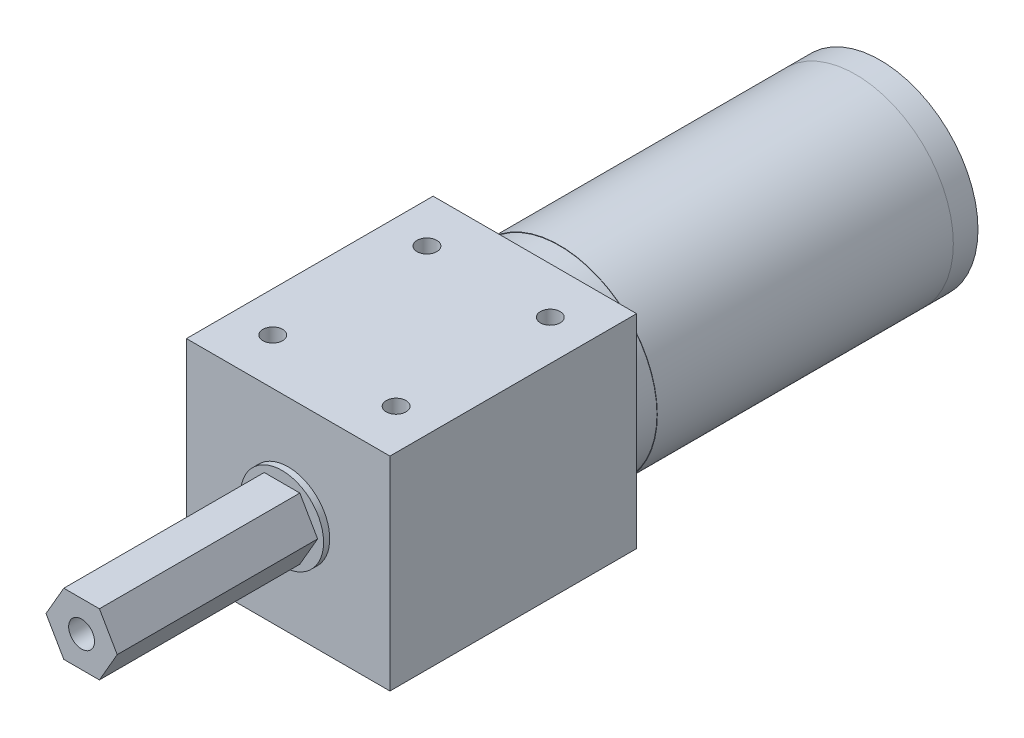
from build123d import *

# Parameters (mm, degrees)
SKETCH1_W           = 41.91
SKETCH1_H           = 41.91
BOSS_EXTRUDE1_DEPTH = 50.8
BOSS_EXTRUDE2_DEPTH = 42.545
SKETCH3_R           = 20.066
BOSS_EXTRUDE3_DEPTH = 5.08
SKETCH4_R           = 20.141371121
BOSS_EXTRUDE4_DEPTH = 60.96
SKETCH5_R           = 20.141371121
BOSS_EXTRUDE5_DEPTH = 5.08
SKETCH6_R           = 8.554692431
BOSS_EXTRUDE6_DEPTH = 1.27
SKETCH7_R           = 2.667
CUT_EXTRUDE1_DEPTH  = 19.05
SKETCH8_R           = 2.032
CUT_EXTRUDE2_DEPTH  = 8.89


with BuildPart() as part:
    # Sketch1 → Boss-Extrude1 (new body)
    with BuildSketch(Plane.XY):
        with Locations((20.955, 20.955)):
            Rectangle(SKETCH1_W, SKETCH1_H)
    extrude(amount=BOSS_EXTRUDE1_DEPTH)

    # Sketch2 → Boss-Extrude2 (add)
    with BuildSketch(Plane.XY.offset(50.8)):
        Polygon((28.287348419, 20.955), (24.621174209, 27.305), (17.288825791, 27.305), (13.622651581, 20.955), (17.288825791, 14.605), (24.621174209, 14.605), align=None)
    extrude(amount=BOSS_EXTRUDE2_DEPTH)

    # Sketch3 → Boss-Extrude3 (add)
    with BuildSketch(Plane(origin=(0, 0, 0), x_dir=(-1, 0, 0), z_dir=(0, 0, -1))):
        with Locations((-20.955, 20.955)):
            Circle(SKETCH3_R)
    extrude(amount=BOSS_EXTRUDE3_DEPTH)

    # Sketch6 → Boss-Extrude6 (add)
    with BuildSketch(Plane.XY.offset(50.8)):
        with Locations(Location((20.955, 20.955, 0), (0, 0, 180))):
            Circle(SKETCH6_R)
    extrude(amount=BOSS_EXTRUDE6_DEPTH)

    # Sketch7 → Cut-Extrude1 (cut)
    with BuildSketch(Plane.XY.offset(93.345)):
        with Locations((20.955, 20.955)):
            Circle(SKETCH7_R)
    extrude(amount=-CUT_EXTRUDE1_DEPTH, mode=Mode.SUBTRACT)

    # Sketch8 → Cut-Extrude2 (cut)
    with BuildSketch(Plane(origin=(0, 41.91, 0), x_dir=(1, 0, 0), z_dir=(0, 1, 0))):
        with Locations(Location((33.655, -9.525, 0), (0, 0, 270))):
            Circle(SKETCH8_R)
        with Locations(Location((8.255, -9.525, 0), (0, 0, 270))):
            Circle(SKETCH8_R)
        with Locations(Location((8.255, -41.275, 0), (0, 0, 270))):
            Circle(SKETCH8_R)
        with Locations(Location((33.655, -41.275, 0), (0, 0, 270))):
            Circle(SKETCH8_R)
    cut_extrude2 = extrude(amount=-CUT_EXTRUDE2_DEPTH, mode=Mode.SUBTRACT)

    # Mirror1: Cut-Extrude2 across plane
    add(cut_extrude2.mirror(Plane.ZX.offset(20.955)), mode=Mode.SUBTRACT)


with BuildPart() as body_2:
    # Sketch4 → Boss-Extrude4 (new body)
    with BuildSketch(Plane(origin=(0, 0, -5.08), x_dir=(-1, 0, 0), z_dir=(0, 0, -1))):
        with Locations(Location((-20.955, 20.955, 0), (0, 0, 180))):
            Circle(SKETCH4_R)
    extrude(amount=BOSS_EXTRUDE4_DEPTH)


with BuildPart() as body_3:
    # Sketch5 → Boss-Extrude5 (new body)
    with BuildSketch(Plane(origin=(0, 0, -66.04), x_dir=(-1, 0, 0), z_dir=(0, 0, -1))):
        with Locations((-20.955, 20.955)):
            Circle(SKETCH5_R)
    extrude(amount=BOSS_EXTRUDE5_DEPTH)


solid = Compound([part.part, body_2.part, body_3.part])
